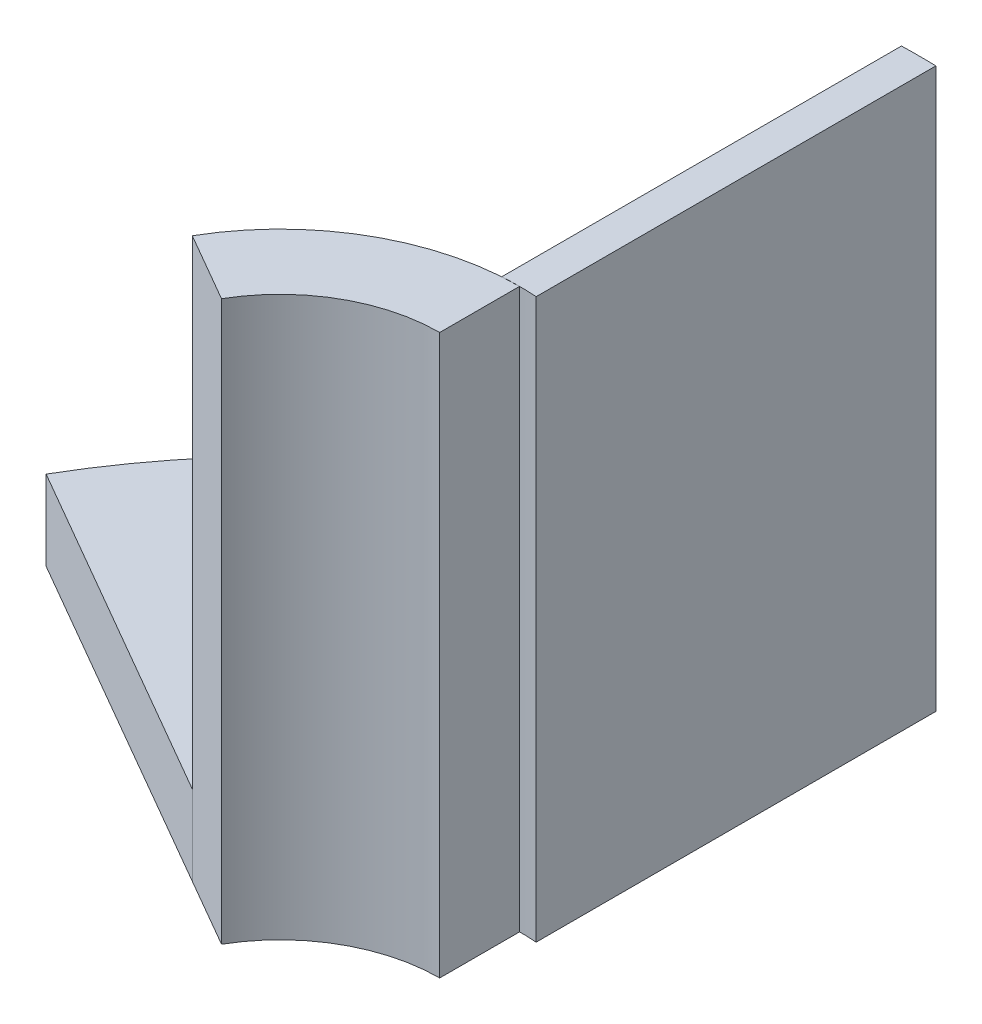
from build123d import *

# Parameters (mm, degrees)
EXTRUDE_313_DEPTH = 5
EXTRUDE_435_DEPTH = 35
EXTRUDE_605_DEPTH = 35


with BuildPart() as part:
    # 草图1 → Extrude 313 (new body)
    with BuildSketch(Plane(origin=(0, 0, 0), x_dir=(1, 0, 0), z_dir=(0, 1, 0))):
        with BuildLine():
            Line((0, 15), (0, 40))
            ThreePointArc((0, 40), (-20, 34.641016151), (-34.641016151, 20))
            Line((-34.641016151, 20), (-12.990381057, 7.5))
            ThreePointArc((-12.990381057, 7.5), (-7.5, 12.990381057), (0, 15))
        make_face()
    extrude(amount=EXTRUDE_313_DEPTH)


with BuildPart() as body_2:
    # 草图2 → Extrude 435 (new body)
    with BuildSketch(Plane(origin=(0, 0, 0), x_dir=(1, 0, 0), z_dir=(0, 1, 0))):
        with BuildLine():
            Line((0, 10), (0, 15))
            ThreePointArc((0, 15), (-7.5, 12.990381057), (-12.990381057, 7.5))
            Line((-12.990381057, 7.5), (-8.660254038, 5))
            ThreePointArc((-8.660254038, 5), (-5, 8.660254038), (0, 10))
        make_face()
    extrude(amount=EXTRUDE_435_DEPTH)


with BuildPart() as body_3:
    # 草图5 → Extrude 605 (new body)
    with BuildSketch(Plane(origin=(0, 0, 0), x_dir=(1, 0, 0), z_dir=(0, 1, 0))):
        with BuildLine():
            Line((1.077839907, 14.961225255), (1.077839907, 39.985475627))
            ThreePointArc((1.077839907, 39.985475627), (0, 40), (-1.077839907, 39.985475627))
            Line((-1.077839907, 39.985475627), (-1.077839907, 14.961225255))
            ThreePointArc((-1.077839907, 14.961225255), (0, 15), (1.077839907, 14.961225255))
        make_face()
    extrude(amount=EXTRUDE_605_DEPTH)


solid = Compound([part.part, body_2.part, body_3.part])
